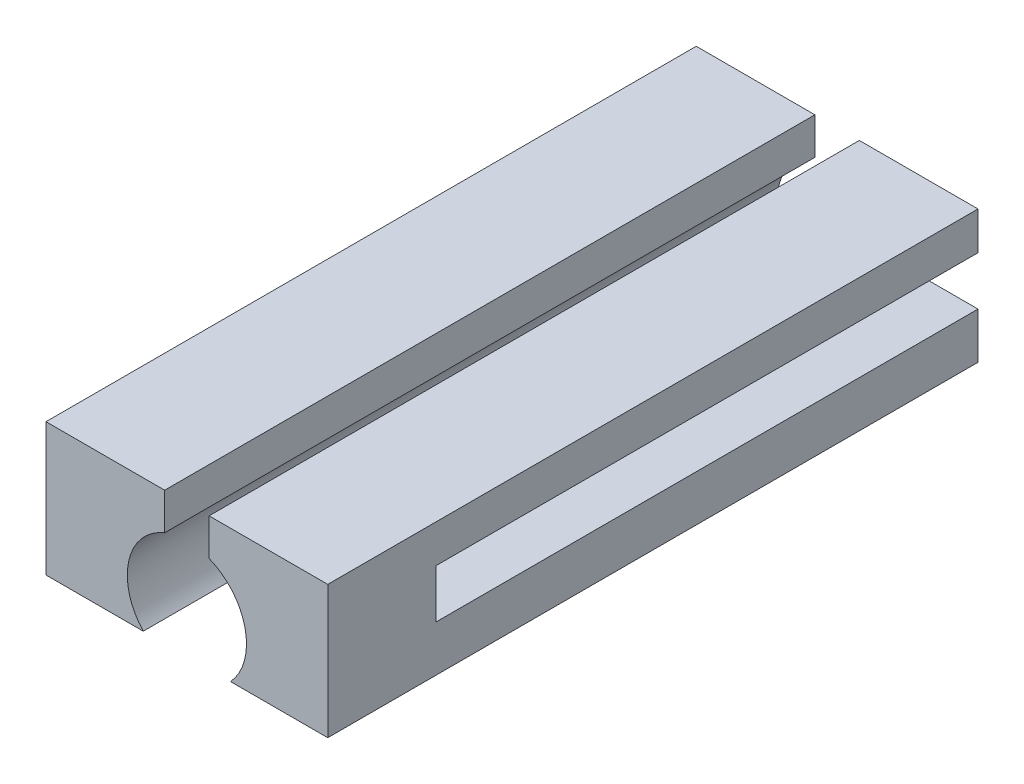
from build123d import *

# Parameters (mm, degrees)
EXTRUDE_1_DEPTH          = 60
EXTRUDE_2_DEPTH          = 11
EXTRUDE_2_DEPTH_BACK     = 7.5
CUT_EXTRUDE_1_DEPTH      = 77.58616063
CUT_EXTRUDE_1_DEPTH_BACK = 77.58616063
CUT_EXTRUDE_2_DEPTH      = 36
CUT_EXTRUDE_2_DEPTH_BACK = 32
SKETCH_4_W               = 53.786075844
SKETCH_4_H               = 12.400008298
EXTRUDE_3_DEPTH          = 120
CUT_EXTRUDE_3_DEPTH      = 100


with BuildPart() as part:
    # 스케치1 → 보스-돌출1 (new, symmetric)
    with BuildSketch(Plane.XY):
        with BuildLine():
            Line((-26, -7.5), (-15.811388301, -7.5))
            ThreePointArc((-15.811388301, -7.5), (-16.835996569, 4.774852829), (-9.519745153, 14.684156503))
            Line((-9.519745153, 14.684156503), (-26, 4))
            Line((-26, 4), (-26, -7.5))
        make_face()
        with BuildLine():
            ThreePointArc((-9.519745153, 14.684156503), (-16.835996569, 4.774852829), (-15.811388301, -7.5))
            Line((-15.811388301, -7.5), (-8.04673847, -7.5))
            ThreePointArc((-8.04673847, -7.5), (-10.736544018, 2.393036259), (-4.1, 10.207350293))
            Line((-4.1, 10.207350293), (-4.1, 17.012936255))
            ThreePointArc((-4.1, 17.012936255), (-6.90870236, 16.078551916), (-9.519745153, 14.684156503))
        make_face()
    extrude(amount=EXTRUDE_1_DEPTH, both=True)

    # 스케치2 → 보스-돌출2 (add, two sides: drawn at the far end of the back side and taken through both)
    with BuildSketch(Plane(origin=(0, 0, 0), x_dir=(1, 0, 0), z_dir=(0, 1, 0)).offset(-EXTRUDE_2_DEPTH_BACK)):
        Polygon((-26, 60), (-26, 70), (-16, 60), align=None)
    extrude(amount=EXTRUDE_2_DEPTH + EXTRUDE_2_DEPTH_BACK)

    # 스케치3 → 컷-돌출1 (cut, two sides: drawn at the far end of the back side and taken through both)
    with BuildSketch(Plane.XY.offset(-CUT_EXTRUDE_1_DEPTH_BACK)):
        Polygon((-26, 4), (-15.202537057, 11), (-26, 11), align=None)
    extrude(amount=CUT_EXTRUDE_1_DEPTH + CUT_EXTRUDE_1_DEPTH_BACK, mode=Mode.SUBTRACT)


with BuildPart() as body_2:
    # 대칭 복사5: mirrored copy
    add(part.part.mirror(Plane(origin=(0, 0, 0), x_dir=(0, 0, 1), z_dir=(1, 0, 0))))


with BuildPart() as cut_extrude_2_tool:
    # 스케치4 → 컷-돌출2 (new, two sides: drawn at the far end of the back side and taken through both)
    with BuildSketch(Plane(origin=(0, 0, 0), x_dir=(1, 0, 0), z_dir=(0, 1, 0)).offset(-CUT_EXTRUDE_2_DEPTH_BACK)):
        with Locations((0.893037922, 66.200004149)):
            Rectangle(SKETCH_4_W, SKETCH_4_H)
    extrude(amount=CUT_EXTRUDE_2_DEPTH + CUT_EXTRUDE_2_DEPTH_BACK)


with BuildPart() as part_1:
    add(part.part)

    # 컷-돌출2: cut by cut_extrude_2_tool
    add(cut_extrude_2_tool.part, mode=Mode.SUBTRACT)



with BuildPart() as body_2_1:
    add(body_2.part)

    # 컷-돌출2: cut by cut_extrude_2_tool
    add(cut_extrude_2_tool.part, mode=Mode.SUBTRACT)


with BuildPart() as part_2:
    add(part_1.part)

    add(body_2_1.part)  # 보스-돌출3 merges body 2
    # 스케치5 → 보스-돌출3 (add)
    with BuildSketch(Plane.XY.offset(60)):
        Polygon((4.1, 17.012936255), (6.90870236, 16.078551916), (26, 4), (26, 17.012936255), align=None)
        Polygon((-26, 17.012936255), (-4.1, 17.012936255), (-6.90870236, 16.078551916), (-26, 4), align=None)
    extrude(amount=-EXTRUDE_3_DEPTH)

    # 스케치9 → 컷-돌출3 (cut)
    with BuildSketch(Plane(origin=(0, 0, -60), x_dir=(-1, 0, 0), z_dir=(0, 0, -1))):
        Polygon((-16, 10.012936255), (-26, 10.012936255), (-26, 1.012936255), (-16.366468409, 1.012936255), (-16.366468409, -2.987063745), (-12.5, -2.987063745), (-12.5, 14.012936255), (-16, 14.012936255), align=None)
    extrude(amount=-CUT_EXTRUDE_3_DEPTH, mode=Mode.SUBTRACT)


solid = part_2.part
